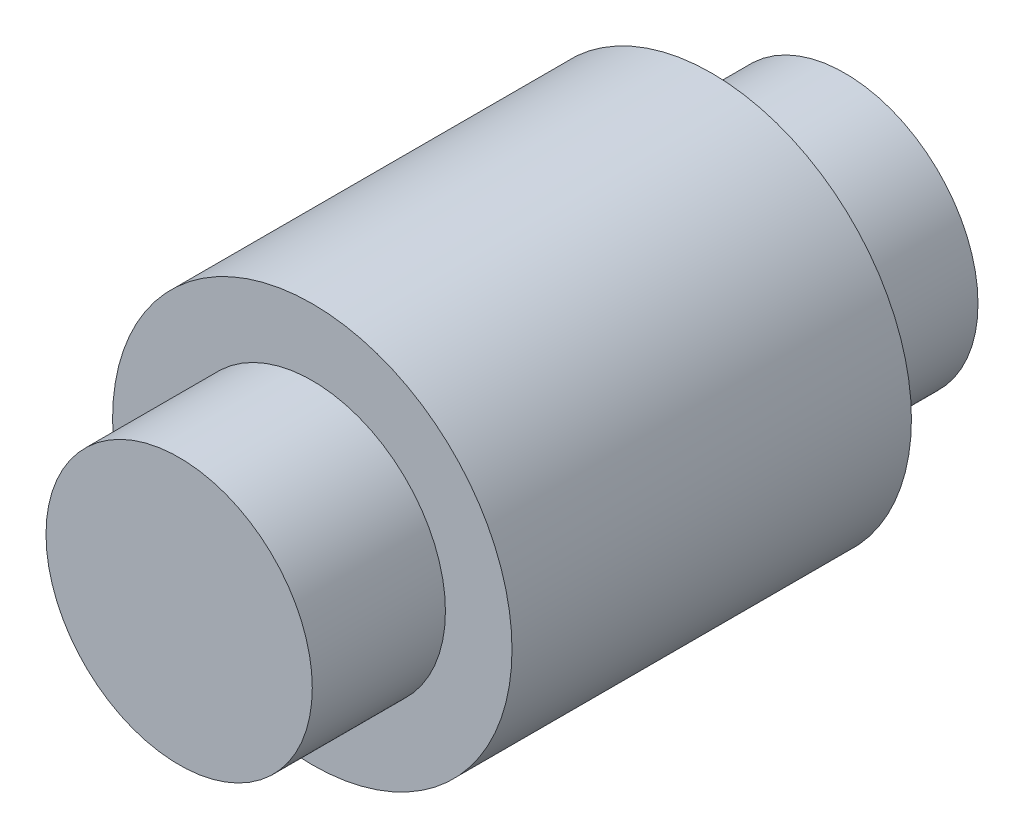
from build123d import *

# Parameters (mm, degrees)
SKETCH_1_R      = 5
EXTRUDE_1_DEPTH = 5
SKETCH_2_R      = 7.5
EXTRUDE_2_DEPTH = 15


with BuildPart() as part:
    # 스케치1 → 보스-돌출1 (new body)
    with BuildSketch(Plane.XY):
        Circle(SKETCH_1_R)
    extrude_1 = extrude(amount=EXTRUDE_1_DEPTH)

    # 스케치2 → 보스-돌출2 (add)
    with BuildSketch(Plane.XY.offset(5)):
        Circle(SKETCH_2_R)
    extrude(amount=EXTRUDE_2_DEPTH)

    # 대칭 복사1: 보스-돌출1 across plane
    add(extrude_1.mirror(Plane(origin=(0, 0, 12.5), x_dir=(1, 0, 0), z_dir=(0, 0, -1))))


solid = part.part
